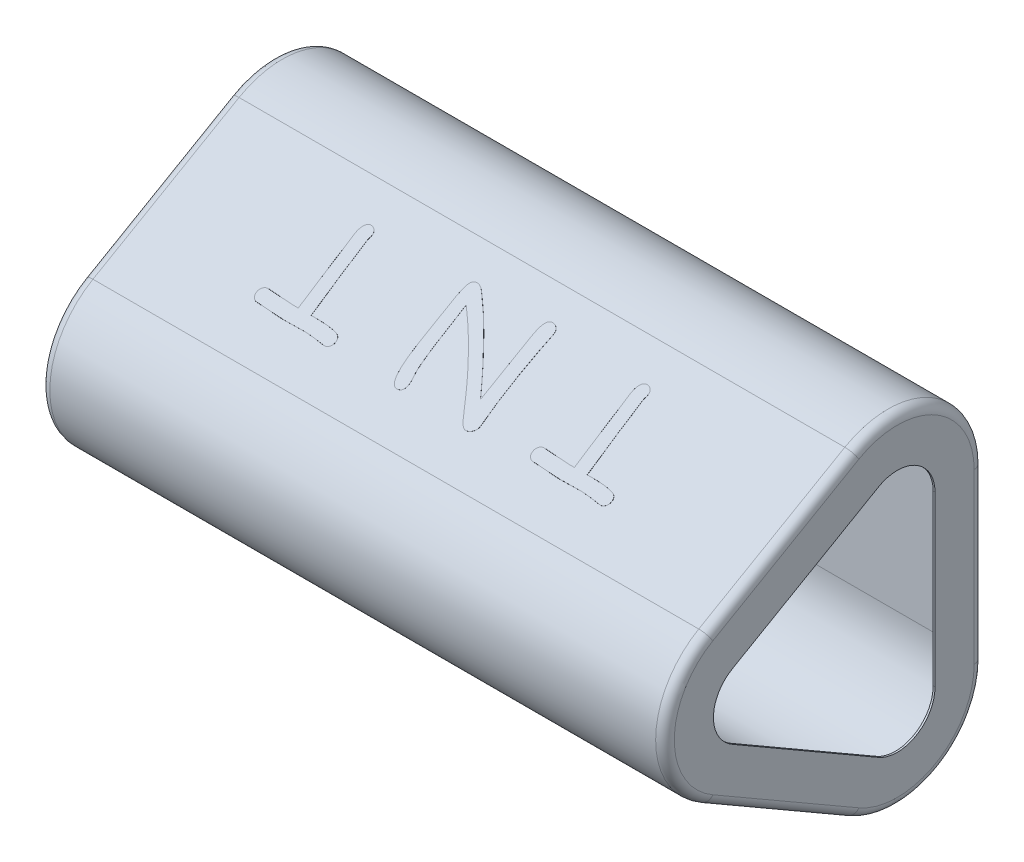
from build123d import *

# Parameters (mm, degrees)
EXTRUDE_THIN1_DEPTH = 67
EXTRUDE_THIN2_DEPTH = 0.2
FILLET1_R           = 1
BOSS_EXTRUDE1_DEPTH = 0.01


with BuildPart() as part:
    # Sketch1 → Extrude-Thin1 (new body)
    with BuildSketch(Plane.YZ):
        with BuildLine():
            Line((-9.05, -0.2), (9.05, -0.2))
            ThreePointArc((9.05, -0.2), (17.060734985, 4.425), (17.060734985, 13.675))
            Line((17.060734985, 13.675), (8.010734985, 29.350059808))
            ThreePointArc((8.010734985, 29.350059808), (0, 33.975059808), (-8.010734985, 29.350059808))
            Line((-8.010734985, 29.350059808), (-17.060734985, 13.675))
            ThreePointArc((-17.060734985, 13.675), (-17.060734985, 4.425), (-9.05, -0.2))
        make_face()
        with BuildLine():
            Line((-9.05, 0), (9.05, 0))
            ThreePointArc((9.05, 0), (16.887529904, 4.525), (16.887529904, 13.575))
            Line((16.887529904, 13.575), (7.837529904, 29.250059808))
            ThreePointArc((7.837529904, 29.250059808), (0, 33.775059808), (-7.837529904, 29.250059808))
            Line((-7.837529904, 29.250059808), (-16.887529904, 13.575))
            ThreePointArc((-16.887529904, 13.575), (-16.887529904, 4.525), (-9.05, 0))
        make_face(mode=Mode.SUBTRACT)
    extrude(amount=EXTRUDE_THIN1_DEPTH)

    # Sketch1<4> → Extrude-Thin2 (add)
    with BuildSketch(Plane.YZ):
        with BuildLine():
            Line((-9.05, 0), (9.05, 0))
            ThreePointArc((9.05, 0), (16.887529904, 4.525), (16.887529904, 13.575))
            Line((16.887529904, 13.575), (7.837529904, 29.250059808))
            ThreePointArc((7.837529904, 29.250059808), (0, 33.775059808), (-7.837529904, 29.250059808))
            Line((-7.837529904, 29.250059808), (-16.887529904, 13.575))
            ThreePointArc((-16.887529904, 13.575), (-16.887529904, 4.525), (-9.05, 0))
        make_face()
        with BuildLine():
            Line((-9.05, 5), (9.05, 5))
            ThreePointArc((9.05, 5), (12.557402885, 7.025), (12.557402885, 11.075))
            Line((12.557402885, 11.075), (3.507402885, 26.750059808))
            ThreePointArc((3.507402885, 26.750059808), (0, 28.775059808), (-3.507402885, 26.750059808))
            Line((-3.507402885, 26.750059808), (-12.557402885, 11.075))
            ThreePointArc((-12.557402885, 11.075), (-12.557402885, 7.025), (-9.05, 5))
        make_face(mode=Mode.SUBTRACT)
    extrude_thin2 = extrude(amount=EXTRUDE_THIN2_DEPTH)

    # Mirror 2: Extrude-Thin2 across plane
    add(extrude_thin2.mirror(Plane.ZY.offset(-33.5)))

    # Fillet1
    fillet1_edges = [part.edges().sort_by_distance(p)[0] for p in [
        (0.2, -12.362529904, 21.412529904),
        (0.2, 0, 33.775059808),
        (0.2, 12.362529904, 21.412529904),
        (0.2, 16.887529904, 4.525),
        (0.2, 0, 0),
        (0, 12.535734985, 21.512529904),
        (0, 17.060734985, 4.425),
        (0, 0, -0.2),
        (0, -17.060734985, 4.425),
        (0, -12.535734985, 21.512529904),
        (0.2, -16.887529904, 4.525),
        (0, 0, 33.975059808),
        (67, -12.535734985, 21.512529904),
        (67, 0, 33.975059808),
        (67, 12.535734985, 21.512529904),
        (67, 17.060734985, 4.425),
        (67, 0, -0.2),
        (66.8, -12.362529904, 21.412529904),
        (66.8, 0, 33.775059808),
        (66.8, 12.362529904, 21.412529904),
        (66.8, 16.887529904, 4.525),
        (66.8, 0, 0),
        (67, -17.060734985, 4.425),
        (66.8, -16.887529904, 4.525),
    ]]
    fillet(fillet1_edges, radius=FILLET1_R)

    # Sketch2 → Boss-Extrude1 (add)
    with BuildSketch(Plane(origin=(0, 18.716999937, 10.806264952), x_dir=(-1, 0, 0), z_dir=(0, 0.8660254037844387, 0.49999999999999994))):
        with BuildLine():
            add(Edge.make_bspline(
                [(-44.017578125, 15.167998654), (-44.05989797, 15.168538961), (-44.149107716, 15.169677922), (-44.291039074, 15.173839912), (-44.448588189, 15.179822055), (-44.622490206, 15.187075116), (-44.81187064, 15.199598258), (-45.017604193, 15.213177267), (-45.238970191, 15.228678007), (-45.39193234, 15.24019352), (-45.470703125, 15.246123654)],
                knots=[0, 0, 0, 0, 0.697868793, 1.471099364, 2.34124454, 3.297639375, 4.340941311, 5.470636532, 6.697455892, 8, 8, 8, 8], degree=3))
            add(Edge.make_bspline(
                [(-45.470703125, 15.246123654), (-45.62041297, 15.257012529), (-45.900187708, 15.277361439), (-46.291503745, 15.298879394), (-46.625554899, 15.312170024), (-46.829417599, 15.312417615), (-46.921875, 15.312529904)],
                knots=[0, 0, 0, 0, 1.239602774, 2.316544658, 3.236506215, 4, 4, 4, 4], degree=3))
            Line((-46.921875, 15.312529904), (-47.375, 15.312529904))
            add(Edge.make_bspline(
                [(-47.375, 15.312529904), (-47.373929914, 15.231144668), (-47.371635327, 15.056630225), (-47.362818393, 14.776715079), (-47.353419717, 14.461601122), (-47.341309649, 14.110701666), (-47.328425378, 13.725228303), (-47.309764038, 13.304071505), (-47.29113897, 12.847622086), (-47.275623853, 12.53126948), (-47.267578125, 12.367217404)],
                knots=[0, 0, 0, 0, 0.662748673, 1.421132645, 2.280353958, 3.229821545, 4.280136861, 5.420916878, 6.662555861, 8, 8, 8, 8], degree=3))
            add(Edge.make_bspline(
                [(-47.267578125, 12.367217404), (-47.26024819, 12.21357956), (-47.245993967, 11.914806358), (-47.228006323, 11.479261837), (-47.21582659, 11.070308208), (-47.200711595, 10.688239421), (-47.190963208, 10.332749942), (-47.185553291, 10.003295098), (-47.181338586, 9.700560115), (-47.180220219, 9.507843539), (-47.1796875, 9.416045529)],
                knots=[0, 0, 0, 0, 1.250205099, 2.431222486, 3.543103862, 4.575656673, 5.539115669, 6.433559639, 7.253846715, 8, 8, 8, 8], degree=3))
            add(Edge.make_bspline(
                [(-47.1796875, 9.416045529), (-47.179267483, 9.372419706), (-47.178339392, 9.276021932), (-47.171199991, 9.116564019), (-47.164384793, 8.927689329), (-47.152013838, 8.718793839), (-47.141532141, 8.509788356), (-47.129972639, 8.319801118), (-47.127004533, 8.158240458), (-47.125622369, 8.059924988), (-47.125, 8.015654904)],
                knots=[0, 0, 0, 0, 0.746989454, 1.650584799, 2.732845727, 3.983195791, 5.233545855, 6.316323389, 7.241863914, 8, 8, 8, 8], degree=3))
            add(Edge.make_bspline(
                [(-47.125, 8.015654904), (-47.12714051, 7.943972707), (-47.131299134, 7.80470719), (-47.155671207, 7.603555997), (-47.200142327, 7.417193289), (-47.245424114, 7.302323458), (-47.267578125, 7.246123654)],
                knots=[0, 0, 0, 0, 1.091849351, 2.121265404, 3.080833362, 4, 4, 4, 4], degree=3))
            add(Edge.make_bspline(
                [(-47.267578125, 7.246123654), (-47.28326141, 7.211973825), (-47.313209379, 7.146763126), (-47.365858015, 7.057200204), (-47.426616771, 6.981467555), (-47.496107346, 6.921769713), (-47.568406282, 6.869888136), (-47.65053776, 6.838295054), (-47.73693716, 6.814547172), (-47.797349721, 6.813210718), (-47.828125, 6.812529904)],
                knots=[0, 0, 0, 0, 1.191296126, 2.274835755, 3.287394835, 4.252751747, 5.174740045, 6.091162971, 7.027603017, 8, 8, 8, 8], degree=3))
            add(Edge.make_bspline(
                [(-47.828125, 6.812529904), (-47.870062162, 6.814697433), (-47.953492641, 6.819009551), (-48.074388843, 6.856621059), (-48.189598816, 6.914015385), (-48.295868245, 6.992926283), (-48.38612357, 7.091787727), (-48.45143659, 7.207338536), (-48.492543478, 7.335867255), (-48.497463631, 7.426146592), (-48.5, 7.472686154)],
                knots=[0, 0, 0, 0, 0.960963467, 1.911756486, 2.881171454, 3.906711639, 4.933449695, 5.93104195, 6.933439213, 8, 8, 8, 8], degree=3))
            add(Edge.make_bspline(
                [(-48.5, 7.472686154), (-48.49810678, 7.513776945), (-48.493545732, 7.612770716), (-48.466587023, 7.768228657), (-48.440173562, 7.923767969), (-48.435514964, 8.023396184), (-48.43359375, 8.064483029)],
                knots=[0, 0, 0, 0, 0.827477602, 1.993515503, 3.172522398, 4, 4, 4, 4], degree=3))
            add(Edge.make_bspline(
                [(-48.43359375, 8.064483029), (-48.433945378, 8.12503569), (-48.434728275, 8.259855578), (-48.443381909, 8.482545262), (-48.457571052, 8.745514333), (-48.474370616, 9.035197682), (-48.492539018, 9.324783595), (-48.503343918, 9.588536107), (-48.512646952, 9.812465273), (-48.513353978, 9.948590295), (-48.513671875, 10.009795529)],
                knots=[0, 0, 0, 0, 0.746291465, 1.661610404, 2.746329365, 3.99217145, 5.238013535, 6.322346595, 7.245684818, 8, 8, 8, 8], degree=3))
            add(Edge.make_bspline(
                [(-48.513671875, 10.009795529), (-48.514285161, 10.092476974), (-48.51556973, 10.265658845), (-48.51836301, 10.537215308), (-48.529921283, 10.832716091), (-48.540437935, 11.152449856), (-48.557332365, 11.496121586), (-48.573349693, 11.86346258), (-48.598435141, 12.254582115), (-48.614672428, 12.523462916), (-48.623046875, 12.662139279)],
                knots=[0, 0, 0, 0, 0.747431598, 1.565545969, 2.45468398, 3.420487031, 4.457335108, 5.565002064, 6.744139946, 8, 8, 8, 8], degree=3))
            add(Edge.make_bspline(
                [(-48.623046875, 12.662139279), (-48.632289133, 12.810568979), (-48.650082249, 13.096324573), (-48.673725506, 13.509079726), (-48.692857726, 13.889346509), (-48.710059174, 14.237017178), (-48.727357612, 14.551997365), (-48.735849207, 14.834661763), (-48.744088557, 15.084647348), (-48.748125312, 15.240261829), (-48.75, 15.312529904)],
                knots=[0, 0, 0, 0, 1.345045701, 2.589470545, 3.739184836, 4.788629233, 5.737804393, 6.592105666, 7.346167443, 8, 8, 8, 8], degree=3))
            Line((-48.75, 15.312529904), (-49.345703125, 15.306670529))
            add(Edge.make_bspline(
                [(-49.345703125, 15.306670529), (-49.461596944, 15.307508792), (-49.687565981, 15.309143232), (-50.017042777, 15.319243646), (-50.327139692, 15.333692365), (-50.61816732, 15.357902878), (-50.889819592, 15.386535193), (-51.142788201, 15.421046505), (-51.376031684, 15.463871329), (-51.52421394, 15.49880262), (-51.595703125, 15.515654904)],
                knots=[0, 0, 0, 0, 1.228039821, 2.394424294, 3.492699509, 4.517052489, 5.488393293, 6.38694271, 7.221795155, 8, 8, 8, 8], degree=3))
            add(Edge.make_bspline(
                [(-51.595703125, 15.515654904), (-51.637840188, 15.52807738), (-51.718306207, 15.551799659), (-51.826438777, 15.605479444), (-51.919614445, 15.66830987), (-51.994386011, 15.745974198), (-52.05458051, 15.834778948), (-52.094687897, 15.936249654), (-52.121809702, 16.048093443), (-52.123903938, 16.126803912), (-52.125, 16.167998654)],
                knots=[0, 0, 0, 0, 1.149028852, 2.19421508, 3.150112674, 4.078991136, 5.001582701, 5.94244518, 6.923136375, 8, 8, 8, 8], degree=3))
            add(Edge.make_bspline(
                [(-52.125, 16.167998654), (-52.123611356, 16.211900615), (-52.120874019, 16.298441473), (-52.08462131, 16.421647451), (-52.035160419, 16.539373656), (-51.983403044, 16.606468335), (-51.95703125, 16.640654904)],
                knots=[0, 0, 0, 0, 1.025624002, 2.021740715, 2.992022952, 4, 4, 4, 4], degree=3))
            add(Edge.make_bspline(
                [(-51.95703125, 16.640654904), (-51.923380978, 16.675665292), (-51.858261502, 16.743416841), (-51.735925121, 16.814170265), (-51.599389499, 16.852898552), (-51.504152917, 16.852036575), (-51.455078125, 16.851592404)],
                knots=[0, 0, 0, 0, 1.02661616, 1.986691385, 2.962555135, 4, 4, 4, 4], degree=3))
            add(Edge.make_bspline(
                [(-51.455078125, 16.851592404), (-51.432932186, 16.850439617), (-51.382705767, 16.847825126), (-51.298715604, 16.839573915), (-51.196647755, 16.827225581), (-51.076176956, 16.813786776), (-50.936731294, 16.79855123), (-50.779342047, 16.778305087), (-50.603382127, 16.757597028), (-50.480445683, 16.741098521), (-50.416015625, 16.732451779)],
                knots=[0, 0, 0, 0, 0.5087507, 1.153833472, 1.935733641, 2.867738609, 3.935007618, 5.154125614, 6.508498809, 8, 8, 8, 8], degree=3))
            add(Edge.make_bspline(
                [(-50.416015625, 16.732451779), (-50.313179754, 16.721136023), (-50.117423411, 16.699595573), (-49.838914087, 16.672828297), (-49.590624034, 16.659328843), (-49.435557675, 16.655917027), (-49.36328125, 16.654326779)],
                knots=[0, 0, 0, 0, 1.175525529, 2.237707298, 3.178595432, 4, 4, 4, 4], degree=3))
            add(Edge.make_bspline(
                [(-49.36328125, 16.654326779), (-49.290365509, 16.655059897), (-49.126957391, 16.656702854), (-48.856743121, 16.657374687), (-48.535823561, 16.665123326), (-48.181615114, 16.669217922), (-47.8274841, 16.677516009), (-47.506535112, 16.68431821), (-47.236324403, 16.685183376), (-47.072915909, 16.686805903), (-47, 16.687529904)],
                knots=[0, 0, 0, 0, 0.740441683, 1.659369853, 2.743726197, 3.999939121, 5.256273803, 6.340630147, 7.259558317, 8, 8, 8, 8], degree=3))
            add(Edge.make_bspline(
                [(-47, 16.687529904), (-46.95573099, 16.686797812), (-46.861985919, 16.685247515), (-46.714138495, 16.684522357), (-46.551419317, 16.677378698), (-46.373593844, 16.67065073), (-46.180397363, 16.657202746), (-45.971881144, 16.647207045), (-45.748681132, 16.630427834), (-45.515622454, 16.613353883), (-45.281931046, 16.595981034), (-45.058690363, 16.579892841), (-44.850297737, 16.568317188), (-44.657512134, 16.559375579), (-44.479254364, 16.548387098), (-44.316449304, 16.542347413), (-44.168615461, 16.541311765), (-44.07551974, 16.539807653), (-44.03125, 16.539092404)],
                knots=[0, 0, 0, 0, 0.714819212, 1.513717576, 2.38669285, 3.344109317, 4.386598804, 5.513033055, 6.714223687, 8.000039341, 9.285854994, 10.497530974, 11.613470957, 12.65537741, 13.613313006, 14.496792413, 15.285180788, 16, 16, 16, 16], degree=3))
            add(Edge.make_bspline(
                [(-44.03125, 16.539092404), (-43.986033948, 16.537219007), (-43.898483751, 16.533591616), (-43.773179988, 16.494187075), (-43.660589617, 16.430527299), (-43.560583278, 16.344452758), (-43.480208816, 16.239194052), (-43.416217463, 16.121560212), (-43.381662157, 15.988923674), (-43.377250558, 15.896691253), (-43.375, 15.849639279)],
                knots=[0, 0, 0, 0, 1.019441967, 1.973908376, 2.93606128, 3.927491239, 4.934424242, 5.91541954, 6.936560224, 8, 8, 8, 8], degree=3))
            add(Edge.make_bspline(
                [(-43.375, 15.849639279), (-43.377010217, 15.803130744), (-43.380923252, 15.712598456), (-43.418625024, 15.583357348), (-43.474104474, 15.463320443), (-43.557782438, 15.361525677), (-43.653551108, 15.274847333), (-43.764867782, 15.212435279), (-43.887448643, 15.173899374), (-43.973674682, 15.169989455), (-44.017578125, 15.167998654)],
                knots=[0, 0, 0, 0, 1.065832428, 2.074721264, 3.071561902, 4.083108628, 5.07938795, 6.023783637, 6.993776074, 8, 8, 8, 8], degree=3))
        make_face()
        with BuildLine():
            add(Edge.make_bspline(
                [(-28.625, 8.283233029), (-28.626341642, 8.222004136), (-28.629429516, 8.081082024), (-28.651047849, 7.844003524), (-28.685035728, 7.553767673), (-28.713202038, 7.34308852), (-28.728515625, 7.228545529)],
                knots=[0, 0, 0, 0, 0.692895526, 1.594742227, 2.692298624, 4, 4, 4, 4], degree=3))
            add(Edge.make_bspline(
                [(-28.728515625, 7.228545529), (-28.738296881, 7.176169663), (-28.756815143, 7.077009596), (-28.803291029, 6.939076388), (-28.868023257, 6.822936637), (-28.946873032, 6.726722532), (-29.04191292, 6.651599912), (-29.1527084, 6.599178494), (-29.278801842, 6.56689279), (-29.36763273, 6.564027515), (-29.4140625, 6.562529904)],
                knots=[0, 0, 0, 0, 1.20476354, 2.28090613, 3.276722631, 4.197121598, 5.078254434, 5.994044583, 6.951535305, 8, 8, 8, 8], degree=3))
            add(Edge.make_bspline(
                [(-29.4140625, 6.562529904), (-29.444105296, 6.564341393), (-29.506823368, 6.568123101), (-29.602414714, 6.59011806), (-29.701657936, 6.628751302), (-29.804438456, 6.682050659), (-29.912721429, 6.748575998), (-30.023358964, 6.832254314), (-30.141274157, 6.926569123), (-30.216723578, 6.9993748), (-30.255859375, 7.037139279)],
                knots=[0, 0, 0, 0, 0.730337079, 1.524669504, 2.370705184, 3.311529783, 4.334280597, 5.454178941, 6.679476486, 8, 8, 8, 8], degree=3))
            add(Edge.make_bspline(
                [(-30.255859375, 7.037139279), (-30.371054679, 7.145231139), (-30.605434896, 7.365158449), (-30.951436709, 7.712682082), (-31.307745581, 8.073851668), (-31.670829061, 8.451803177), (-32.0384088, 8.849869173), (-32.412414885, 9.264369787), (-32.791709912, 9.697515681), (-33.179019739, 10.146912612), (-33.572464727, 10.614238047), (-33.97112165, 11.10018702), (-34.378253574, 11.601594154), (-34.78888993, 12.122986318), (-35.207504895, 12.660263977), (-35.631920811, 13.215201176), (-36.060383239, 13.789548933), (-36.348417338, 14.178334207), (-36.494140625, 14.375029904)],
                knots=[0, 0, 0, 0, 0.786175539, 1.599579029, 2.440502605, 3.311377504, 4.207922437, 5.137132747, 6.090019436, 7.073419425, 8.089895893, 9.130444579, 10.201783443, 11.304500224, 12.433614388, 13.591759313, 14.781613883, 16, 16, 16, 16], degree=3))
            Line((-36.494140625, 14.375029904), (-36.494140625, 12.878936154))
            Line((-36.494140625, 12.878936154), (-36.494140625, 11.375029904))
            add(Edge.make_bspline(
                [(-36.494140625, 11.375029904), (-36.494143082, 11.326852832), (-36.494148328, 11.223988272), (-36.49410346, 11.061227653), (-36.494299898, 10.88154104), (-36.493462708, 10.68491972), (-36.497032062, 10.471391199), (-36.495200895, 10.240258058), (-36.498910046, 9.992223413), (-36.497748529, 9.732450574), (-36.498337611, 9.472687372), (-36.497253044, 9.224633161), (-36.500661408, 8.993525048), (-36.499843144, 8.779326115), (-36.500036609, 8.582061309), (-36.4999915, 8.401722577), (-36.50000179, 8.238311162), (-36.500000574, 8.134795532), (-36.5, 8.085967404)],
                knots=[0, 0, 0, 0, 0.703082575, 1.50117631, 2.375278971, 3.32539056, 4.370556493, 5.491688168, 6.69836729, 7.990519051, 9.282670811, 10.489312528, 11.610484461, 12.655607208, 13.615219913, 14.489322574, 15.287416309, 16, 16, 16, 16], degree=3))
            add(Edge.make_bspline(
                [(-36.5, 8.085967404), (-36.499954899, 8.014334119), (-36.499867519, 7.875549821), (-36.511120292, 7.67439153), (-36.523475886, 7.487306003), (-36.543436936, 7.314032973), (-36.567665663, 7.154749565), (-36.600291428, 7.00921889), (-36.632904281, 6.876264992), (-36.677490174, 6.759043417), (-36.722834903, 6.653621877), (-36.778328209, 6.564191487), (-36.836619308, 6.486388556), (-36.901691971, 6.422883823), (-36.972887178, 6.37324155), (-37.049361342, 6.337336368), (-37.132495771, 6.317577356), (-37.189353201, 6.314250155), (-37.21875, 6.312529904)],
                knots=[0, 0, 0, 0, 1.641407543, 3.180108141, 4.616353063, 5.93787564, 7.176700562, 8.306389524, 9.355981834, 10.309543231, 11.177673963, 11.981208954, 12.715390035, 13.401281728, 14.055269273, 14.696189502, 15.325895391, 16, 16, 16, 16], degree=3))
            add(Edge.make_bspline(
                [(-37.21875, 6.312529904), (-37.279052122, 6.314428386), (-37.39501513, 6.31807923), (-37.557036992, 6.366266364), (-37.70419125, 6.434780806), (-37.781538131, 6.506863332), (-37.8203125, 6.542998654)],
                knots=[0, 0, 0, 0, 1.089169767, 2.094510084, 3.044768586, 4, 4, 4, 4], degree=3))
            add(Edge.make_bspline(
                [(-37.8203125, 6.542998654), (-37.850008132, 6.577669914), (-37.908237331, 6.645655659), (-37.965947, 6.766859235), (-38.006112271, 6.895245999), (-38.009827158, 6.985382889), (-38.01171875, 7.031279904)],
                knots=[0, 0, 0, 0, 1.015946988, 1.992137409, 2.977611725, 4, 4, 4, 4], degree=3))
            add(Edge.make_bspline(
                [(-38.01171875, 7.031279904), (-38.011367824, 7.083369973), (-38.010586688, 7.199318518), (-38.001894458, 7.391413044), (-37.987658001, 7.61856056), (-37.971429246, 7.869268163), (-37.951009633, 8.119678658), (-37.937722004, 8.346939594), (-37.928836719, 8.539020433), (-37.928076089, 8.654970432), (-37.927734375, 8.707061154)],
                knots=[0, 0, 0, 0, 0.744877641, 1.658041175, 2.749287466, 3.999670801, 5.250712534, 6.341958825, 7.255122359, 8, 8, 8, 8], degree=3))
            add(Edge.make_bspline(
                [(-37.927734375, 8.707061154), (-37.92715099, 8.783884638), (-37.925860579, 8.95381353), (-37.922089462, 9.234433227), (-37.914136414, 9.565173104), (-37.902050861, 9.930360505), (-37.891548846, 10.294956653), (-37.879985967, 10.626269156), (-37.87701405, 10.906275652), (-37.875623382, 11.076202202), (-37.875, 11.152373654)],
                knots=[0, 0, 0, 0, 0.75381508, 1.667393282, 2.753659635, 3.999915791, 5.252556976, 6.332607107, 7.252572722, 8, 8, 8, 8], degree=3))
            add(Edge.make_bspline(
                [(-37.875, 11.152373654), (-37.875757818, 11.234403567), (-37.877441849, 11.416691218), (-37.877610816, 11.71817502), (-37.88798341, 12.074877471), (-37.894205106, 12.468785364), (-37.902296884, 12.862649499), (-37.908036732, 13.2194234), (-37.912245739, 13.520855139), (-37.913498689, 13.703154035), (-37.9140625, 13.785186154)],
                knots=[0, 0, 0, 0, 0.747704683, 1.661556449, 2.747733668, 4.000027837, 5.252322007, 6.338385755, 7.252295317, 8, 8, 8, 8], degree=3))
            add(Edge.make_bspline(
                [(-37.9140625, 13.785186154), (-37.915702055, 13.8626692), (-37.919354837, 14.035294449), (-37.933058318, 14.319323885), (-37.959428664, 14.65392137), (-37.994863422, 15.021392239), (-38.026123668, 15.389233939), (-38.053434402, 15.723690052), (-38.066943141, 16.007736787), (-38.07061673, 16.180360188), (-38.072265625, 16.257842404)],
                knots=[0, 0, 0, 0, 0.750464522, 1.671967386, 2.753134315, 4.000278919, 5.246865685, 6.328032614, 7.249535478, 8, 8, 8, 8], degree=3))
            add(Edge.make_bspline(
                [(-38.072265625, 16.257842404), (-38.069664577, 16.307814555), (-38.064458032, 16.407844352), (-38.008611257, 16.551640611), (-37.925041846, 16.688789338), (-37.811168591, 16.814456693), (-37.676852305, 16.922397034), (-37.529002007, 17.004887111), (-37.369536689, 17.053580382), (-37.260084006, 17.059536589), (-37.205078125, 17.062529904)],
                knots=[0, 0, 0, 0, 0.918927669, 1.8394275, 2.810753833, 3.875264035, 4.953204733, 5.981019229, 6.985353173, 8, 8, 8, 8], degree=3))
            add(Edge.make_bspline(
                [(-37.205078125, 17.062529904), (-37.174216187, 17.059975747), (-37.108740602, 17.054556938), (-37.009522361, 17.016621789), (-36.907462044, 16.953117929), (-36.798315156, 16.869216597), (-36.685217961, 16.760555952), (-36.567871061, 16.627541244), (-36.443129391, 16.472377071), (-36.362592706, 16.3573119), (-36.3203125, 16.296904904)],
                knots=[0, 0, 0, 0, 0.614134886, 1.302926644, 2.087606647, 3.002747992, 4.038777296, 5.204520825, 6.532427355, 8, 8, 8, 8], degree=3))
            add(Edge.make_bspline(
                [(-36.3203125, 16.296904904), (-36.181977217, 16.095500295), (-35.910805979, 15.700697637), (-35.506064133, 15.123688049), (-35.111434314, 14.573411186), (-34.728773442, 14.047406091), (-34.35658284, 13.547339289), (-33.992351617, 13.075214), (-33.642225249, 12.626871403), (-33.407452601, 12.340733321), (-33.29296875, 12.201201779)],
                knots=[0, 0, 0, 0, 1.151001266, 2.256246075, 3.320096876, 4.340853426, 5.320419307, 6.256497473, 7.149803502, 8, 8, 8, 8], degree=3))
            add(Edge.make_bspline(
                [(-33.29296875, 12.201201779), (-33.029082761, 11.880146007), (-32.499925937, 11.236349599), (-31.659789776, 10.304165366), (-30.78898842, 9.387625621), (-30.180523719, 8.799331682), (-29.875, 8.503936154)],
                knots=[0, 0, 0, 0, 0.989655899, 1.984505403, 2.98797514, 4, 4, 4, 4], degree=3))
            add(Edge.make_bspline(
                [(-29.875, 8.503936154), (-29.87572578, 8.556669409), (-29.877338602, 8.673852796), (-29.87817015, 8.866602201), (-29.88513487, 9.093140184), (-29.889986532, 9.255239084), (-29.892578125, 9.341826779)],
                knots=[0, 0, 0, 0, 0.755108433, 1.677995494, 2.759664502, 4, 4, 4, 4], degree=3))
            Line((-29.892578125, 9.341826779), (-29.91015625, 10.171904904))
            add(Edge.make_bspline(
                [(-29.91015625, 10.171904904), (-29.911248412, 10.406931349), (-29.913375309, 10.864626237), (-29.919972088, 11.53331334), (-29.936082142, 12.164846726), (-29.95721718, 12.759952903), (-29.984431279, 13.317299465), (-30.016745439, 13.838316425), (-30.058014935, 14.322007679), (-30.09006869, 14.632233508), (-30.10546875, 14.781279904)],
                knots=[0, 0, 0, 0, 1.222063937, 2.379870134, 3.476998434, 4.506762587, 5.476079524, 6.378370929, 7.220896693, 8, 8, 8, 8], degree=3))
            add(Edge.make_bspline(
                [(-30.10546875, 14.781279904), (-30.11107003, 14.817132584), (-30.12467391, 14.904208324), (-30.156650956, 15.056028533), (-30.204773737, 15.25075454), (-30.240255014, 15.395207055), (-30.259765625, 15.474639279)],
                knots=[0, 0, 0, 0, 0.612720744, 1.488120632, 2.618756033, 4, 4, 4, 4], degree=3))
            add(Edge.make_bspline(
                [(-30.259765625, 15.474639279), (-30.277525626, 15.544770897), (-30.310901259, 15.676566341), (-30.34529882, 15.863905363), (-30.368967138, 16.02614056), (-30.373111268, 16.126269892), (-30.375, 16.171904904)],
                knots=[0, 0, 0, 0, 1.225438933, 2.30291661, 3.226536131, 4, 4, 4, 4], degree=3))
            add(Edge.make_bspline(
                [(-30.375, 16.171904904), (-30.373498065, 16.23194097), (-30.370666199, 16.345137727), (-30.340182674, 16.503286106), (-30.287267756, 16.637413932), (-30.214022566, 16.748098785), (-30.118938942, 16.836005687), (-30.000854305, 16.89648524), (-29.862681292, 16.931722637), (-29.764541586, 16.935527437), (-29.712890625, 16.937529904)],
                knots=[0, 0, 0, 0, 1.242704795, 2.343094109, 3.31739196, 4.211458277, 5.070661166, 5.969597604, 6.931398519, 8, 8, 8, 8], degree=3))
            add(Edge.make_bspline(
                [(-29.712890625, 16.937529904), (-29.668887111, 16.933751777), (-29.580159019, 16.926133613), (-29.451593152, 16.875648012), (-29.336321589, 16.786193257), (-29.228316671, 16.667535803), (-29.131080825, 16.514395419), (-29.044250416, 16.327802526), (-28.962907164, 16.109808784), (-28.890730989, 15.857726564), (-28.830736, 15.57266346), (-28.772767298, 15.255168046), (-28.727115237, 14.903755367), (-28.690836023, 14.518682913), (-28.661750291, 14.100573467), (-28.640825057, 13.648634948), (-28.626520028, 13.163533311), (-28.625517022, 12.828817008), (-28.625, 12.656279904)],
                knots=[0, 0, 0, 0, 0.452142425, 0.911693895, 1.394598139, 1.938988091, 2.553040143, 3.250071099, 4.050101749, 4.941256313, 5.940931112, 7.04166308, 8.256215173, 9.579928512, 11.014741123, 12.561494167, 14.22754425, 16, 16, 16, 16], degree=3))
            add(Edge.make_bspline(
                [(-28.625, 12.656279904), (-28.625, 12.591175738), (-28.625, 12.453805946), (-28.625, 12.237009071), (-28.625, 11.998076779), (-28.625, 11.736358029), (-28.625, 11.451201779), (-28.625, 11.143259071), (-28.625, 10.813180946), (-28.625, 10.468779904), (-28.625, 10.124378863), (-28.625, 9.794951779), (-28.625, 9.487660113), (-28.625, 9.203154904), (-28.625, 8.941436154), (-28.625, 8.702503863), (-28.625, 8.485706988), (-28.625, 8.348337196), (-28.625, 8.283233029)],
                knots=[0, 0, 0, 0, 0.714604734, 1.507815989, 2.379633765, 3.337204109, 4.380527021, 5.509602501, 6.717284502, 8.003573024, 9.289861545, 10.497543546, 11.619472979, 12.662795891, 13.620366235, 14.492184011, 15.285395266, 16, 16, 16, 16], degree=3))
        make_face()
        with BuildLine():
            add(Edge.make_bspline(
                [(-14.392578125, 15.167998654), (-14.43489797, 15.168538961), (-14.524107716, 15.169677922), (-14.666039074, 15.173839912), (-14.823588189, 15.179822055), (-14.997490206, 15.187075116), (-15.18687064, 15.199598258), (-15.392604193, 15.213177267), (-15.613970191, 15.228678007), (-15.76693234, 15.24019352), (-15.845703125, 15.246123654)],
                knots=[0, 0, 0, 0, 0.697868793, 1.471099364, 2.34124454, 3.297639375, 4.340941311, 5.470636532, 6.697455892, 8, 8, 8, 8], degree=3))
            add(Edge.make_bspline(
                [(-15.845703125, 15.246123654), (-15.99541297, 15.257012529), (-16.275187708, 15.277361439), (-16.666503745, 15.298879394), (-17.000554899, 15.312170024), (-17.204417599, 15.312417615), (-17.296875, 15.312529904)],
                knots=[0, 0, 0, 0, 1.239602774, 2.316544658, 3.236506215, 4, 4, 4, 4], degree=3))
            Line((-17.296875, 15.312529904), (-17.75, 15.312529904))
            add(Edge.make_bspline(
                [(-17.75, 15.312529904), (-17.748929914, 15.231144668), (-17.746635327, 15.056630225), (-17.737818393, 14.776715079), (-17.728419717, 14.461601122), (-17.716309649, 14.110701666), (-17.703425378, 13.725228303), (-17.684764038, 13.304071505), (-17.66613897, 12.847622086), (-17.650623853, 12.53126948), (-17.642578125, 12.367217404)],
                knots=[0, 0, 0, 0, 0.662748673, 1.421132645, 2.280353958, 3.229821545, 4.280136861, 5.420916878, 6.662555861, 8, 8, 8, 8], degree=3))
            add(Edge.make_bspline(
                [(-17.642578125, 12.367217404), (-17.63524819, 12.21357956), (-17.620993967, 11.914806358), (-17.603006323, 11.479261837), (-17.59082659, 11.070308208), (-17.575711595, 10.688239421), (-17.565963208, 10.332749942), (-17.560553291, 10.003295098), (-17.556338586, 9.700560115), (-17.555220219, 9.507843539), (-17.5546875, 9.416045529)],
                knots=[0, 0, 0, 0, 1.250205099, 2.431222486, 3.543103862, 4.575656673, 5.539115669, 6.433559639, 7.253846715, 8, 8, 8, 8], degree=3))
            add(Edge.make_bspline(
                [(-17.5546875, 9.416045529), (-17.554267483, 9.372419706), (-17.553339392, 9.276021932), (-17.546199991, 9.116564019), (-17.539384793, 8.927689329), (-17.527013838, 8.718793839), (-17.516532141, 8.509788356), (-17.504972639, 8.319801118), (-17.502004533, 8.158240458), (-17.500622369, 8.059924988), (-17.5, 8.015654904)],
                knots=[0, 0, 0, 0, 0.746989454, 1.650584799, 2.732845727, 3.983195791, 5.233545855, 6.316323389, 7.241863914, 8, 8, 8, 8], degree=3))
            add(Edge.make_bspline(
                [(-17.5, 8.015654904), (-17.50214051, 7.943972707), (-17.506299134, 7.80470719), (-17.530671207, 7.603555997), (-17.575142327, 7.417193289), (-17.620424114, 7.302323458), (-17.642578125, 7.246123654)],
                knots=[0, 0, 0, 0, 1.091849351, 2.121265404, 3.080833362, 4, 4, 4, 4], degree=3))
            add(Edge.make_bspline(
                [(-17.642578125, 7.246123654), (-17.65826141, 7.211973825), (-17.688209379, 7.146763126), (-17.740858015, 7.057200204), (-17.801616771, 6.981467555), (-17.871107346, 6.921769713), (-17.943406282, 6.869888136), (-18.02553776, 6.838295054), (-18.11193716, 6.814547172), (-18.172349721, 6.813210718), (-18.203125, 6.812529904)],
                knots=[0, 0, 0, 0, 1.191296126, 2.274835755, 3.287394835, 4.252751747, 5.174740045, 6.091162971, 7.027603017, 8, 8, 8, 8], degree=3))
            add(Edge.make_bspline(
                [(-18.203125, 6.812529904), (-18.245062162, 6.814697433), (-18.328492641, 6.819009551), (-18.449388843, 6.856621059), (-18.564598816, 6.914015385), (-18.670868245, 6.992926283), (-18.76112357, 7.091787727), (-18.82643659, 7.207338536), (-18.867543478, 7.335867255), (-18.872463631, 7.426146592), (-18.875, 7.472686154)],
                knots=[0, 0, 0, 0, 0.960963467, 1.911756486, 2.881171454, 3.906711639, 4.933449695, 5.93104195, 6.933439213, 8, 8, 8, 8], degree=3))
            add(Edge.make_bspline(
                [(-18.875, 7.472686154), (-18.87310678, 7.513776945), (-18.868545732, 7.612770716), (-18.841587023, 7.768228657), (-18.815173562, 7.923767969), (-18.810514964, 8.023396184), (-18.80859375, 8.064483029)],
                knots=[0, 0, 0, 0, 0.827477602, 1.993515503, 3.172522398, 4, 4, 4, 4], degree=3))
            add(Edge.make_bspline(
                [(-18.80859375, 8.064483029), (-18.808945378, 8.12503569), (-18.809728275, 8.259855578), (-18.818381909, 8.482545262), (-18.832571052, 8.745514333), (-18.849370616, 9.035197682), (-18.867539018, 9.324783595), (-18.878343918, 9.588536107), (-18.887646952, 9.812465273), (-18.888353978, 9.948590295), (-18.888671875, 10.009795529)],
                knots=[0, 0, 0, 0, 0.746291465, 1.661610404, 2.746329365, 3.99217145, 5.238013535, 6.322346595, 7.245684818, 8, 8, 8, 8], degree=3))
            add(Edge.make_bspline(
                [(-18.888671875, 10.009795529), (-18.889285161, 10.092476974), (-18.89056973, 10.265658845), (-18.89336301, 10.537215308), (-18.904921283, 10.832716091), (-18.915437935, 11.152449856), (-18.932332365, 11.496121586), (-18.948349693, 11.86346258), (-18.973435141, 12.254582115), (-18.989672428, 12.523462916), (-18.998046875, 12.662139279)],
                knots=[0, 0, 0, 0, 0.747431598, 1.565545969, 2.45468398, 3.420487031, 4.457335108, 5.565002064, 6.744139946, 8, 8, 8, 8], degree=3))
            add(Edge.make_bspline(
                [(-18.998046875, 12.662139279), (-19.007289133, 12.810568979), (-19.025082249, 13.096324573), (-19.048725506, 13.509079726), (-19.067857726, 13.889346509), (-19.085059174, 14.237017178), (-19.102357612, 14.551997365), (-19.110849207, 14.834661763), (-19.119088557, 15.084647348), (-19.123125312, 15.240261829), (-19.125, 15.312529904)],
                knots=[0, 0, 0, 0, 1.345045701, 2.589470545, 3.739184836, 4.788629233, 5.737804393, 6.592105666, 7.346167443, 8, 8, 8, 8], degree=3))
            Line((-19.125, 15.312529904), (-19.720703125, 15.306670529))
            add(Edge.make_bspline(
                [(-19.720703125, 15.306670529), (-19.836596944, 15.307508792), (-20.062565981, 15.309143232), (-20.392042777, 15.319243646), (-20.702139692, 15.333692365), (-20.99316732, 15.357902878), (-21.264819592, 15.386535193), (-21.517788201, 15.421046505), (-21.751031684, 15.463871329), (-21.89921394, 15.49880262), (-21.970703125, 15.515654904)],
                knots=[0, 0, 0, 0, 1.228039821, 2.394424294, 3.492699509, 4.517052489, 5.488393293, 6.38694271, 7.221795155, 8, 8, 8, 8], degree=3))
            add(Edge.make_bspline(
                [(-21.970703125, 15.515654904), (-22.012840188, 15.52807738), (-22.093306207, 15.551799659), (-22.201438777, 15.605479444), (-22.294614445, 15.66830987), (-22.369386011, 15.745974198), (-22.42958051, 15.834778948), (-22.469687897, 15.936249654), (-22.496809702, 16.048093443), (-22.498903938, 16.126803912), (-22.5, 16.167998654)],
                knots=[0, 0, 0, 0, 1.149028852, 2.19421508, 3.150112674, 4.078991136, 5.001582701, 5.94244518, 6.923136375, 8, 8, 8, 8], degree=3))
            add(Edge.make_bspline(
                [(-22.5, 16.167998654), (-22.498611356, 16.211900615), (-22.495874019, 16.298441473), (-22.45962131, 16.421647451), (-22.410160419, 16.539373656), (-22.358403044, 16.606468335), (-22.33203125, 16.640654904)],
                knots=[0, 0, 0, 0, 1.025624002, 2.021740715, 2.992022952, 4, 4, 4, 4], degree=3))
            add(Edge.make_bspline(
                [(-22.33203125, 16.640654904), (-22.298380978, 16.675665292), (-22.233261502, 16.743416841), (-22.110925121, 16.814170265), (-21.974389499, 16.852898552), (-21.879152917, 16.852036575), (-21.830078125, 16.851592404)],
                knots=[0, 0, 0, 0, 1.02661616, 1.986691385, 2.962555135, 4, 4, 4, 4], degree=3))
            add(Edge.make_bspline(
                [(-21.830078125, 16.851592404), (-21.807932186, 16.850439617), (-21.757705767, 16.847825126), (-21.673715604, 16.839573915), (-21.571647755, 16.827225581), (-21.451176956, 16.813786776), (-21.311731294, 16.79855123), (-21.154342047, 16.778305087), (-20.978382127, 16.757597028), (-20.855445683, 16.741098521), (-20.791015625, 16.732451779)],
                knots=[0, 0, 0, 0, 0.5087507, 1.153833472, 1.935733641, 2.867738609, 3.935007618, 5.154125614, 6.508498809, 8, 8, 8, 8], degree=3))
            add(Edge.make_bspline(
                [(-20.791015625, 16.732451779), (-20.688179754, 16.721136023), (-20.492423411, 16.699595573), (-20.213914087, 16.672828297), (-19.965624034, 16.659328843), (-19.810557675, 16.655917027), (-19.73828125, 16.654326779)],
                knots=[0, 0, 0, 0, 1.175525529, 2.237707298, 3.178595432, 4, 4, 4, 4], degree=3))
            add(Edge.make_bspline(
                [(-19.73828125, 16.654326779), (-19.665365509, 16.655059897), (-19.501957391, 16.656702854), (-19.231743121, 16.657374687), (-18.910823561, 16.665123326), (-18.556615114, 16.669217922), (-18.2024841, 16.677516009), (-17.881535112, 16.68431821), (-17.611324403, 16.685183376), (-17.447915909, 16.686805903), (-17.375, 16.687529904)],
                knots=[0, 0, 0, 0, 0.740441683, 1.659369853, 2.743726197, 3.999939121, 5.256273803, 6.340630147, 7.259558317, 8, 8, 8, 8], degree=3))
            add(Edge.make_bspline(
                [(-17.375, 16.687529904), (-17.33073099, 16.686797812), (-17.236985919, 16.685247515), (-17.089138495, 16.684522357), (-16.926419317, 16.677378698), (-16.748593844, 16.67065073), (-16.555397363, 16.657202746), (-16.346881144, 16.647207045), (-16.123681132, 16.630427834), (-15.890622454, 16.613353883), (-15.656931046, 16.595981034), (-15.433690363, 16.579892841), (-15.225297737, 16.568317188), (-15.032512134, 16.559375579), (-14.854254364, 16.548387098), (-14.691449304, 16.542347413), (-14.543615461, 16.541311765), (-14.45051974, 16.539807653), (-14.40625, 16.539092404)],
                knots=[0, 0, 0, 0, 0.714819212, 1.513717576, 2.38669285, 3.344109317, 4.386598804, 5.513033055, 6.714223687, 8.000039341, 9.285854994, 10.497530974, 11.613470957, 12.65537741, 13.613313006, 14.496792413, 15.285180788, 16, 16, 16, 16], degree=3))
            add(Edge.make_bspline(
                [(-14.40625, 16.539092404), (-14.361033948, 16.537219007), (-14.273483751, 16.533591616), (-14.148179988, 16.494187075), (-14.035589617, 16.430527299), (-13.935583278, 16.344452758), (-13.855208816, 16.239194052), (-13.791217463, 16.121560212), (-13.756662157, 15.988923674), (-13.752250558, 15.896691253), (-13.75, 15.849639279)],
                knots=[0, 0, 0, 0, 1.019441967, 1.973908376, 2.93606128, 3.927491239, 4.934424242, 5.91541954, 6.936560224, 8, 8, 8, 8], degree=3))
            add(Edge.make_bspline(
                [(-13.75, 15.849639279), (-13.752010217, 15.803130744), (-13.755923252, 15.712598456), (-13.793625024, 15.583357348), (-13.849104474, 15.463320443), (-13.932782438, 15.361525677), (-14.028551108, 15.274847333), (-14.139867782, 15.212435279), (-14.262448643, 15.173899374), (-14.348674682, 15.169989455), (-14.392578125, 15.167998654)],
                knots=[0, 0, 0, 0, 1.065832428, 2.074721264, 3.071561902, 4.083108628, 5.07938795, 6.023783637, 6.993776074, 8, 8, 8, 8], degree=3))
        make_face()
    extrude(amount=BOSS_EXTRUDE1_DEPTH)


solid = part.part
